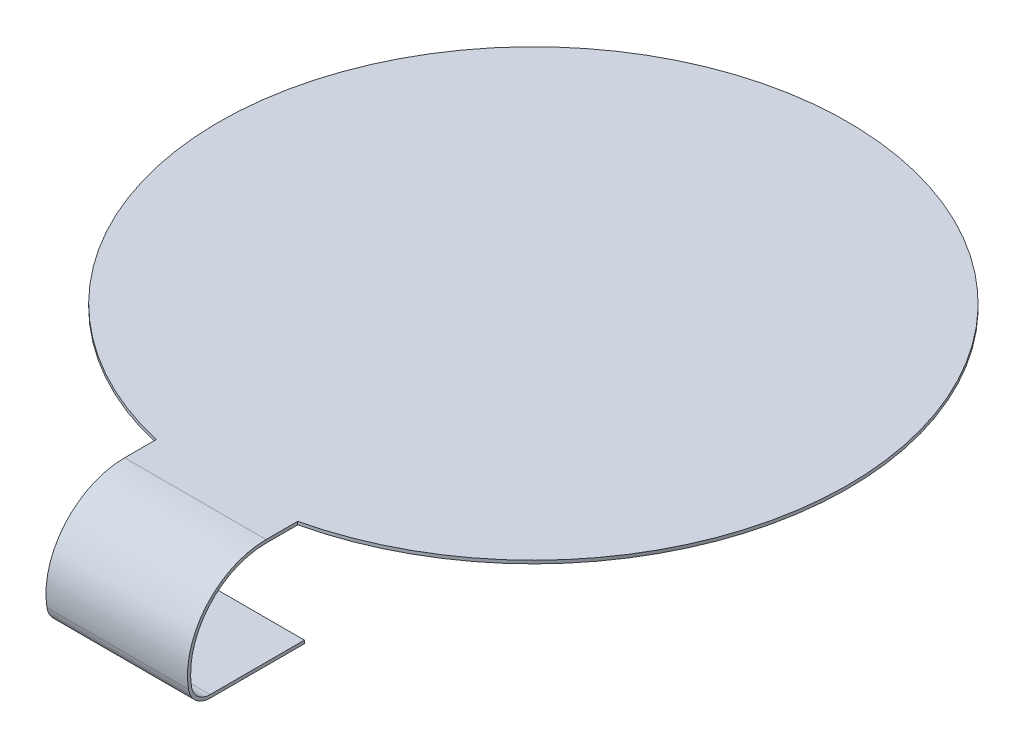
from build123d import *

# Parameters (mm, degrees)
SKETCH1_R                       = 10
BOSS_EXTRUDE1_DEPTH             = 0.1
BOSS_EXTRUDE2_START             = -2.28
SKETCH3_W                       = 4.5
SKETCH3_H                       = 2.5
BOSS_EXTRUDE2_DEPTH             = 0.1
EXTRUDE_THIN1_REACH             = 17.432
EXTRUDE_THIN1_DIRECTION_2_REACH = 17.432


with BuildPart() as part:
    # Sketch1 → Boss-Extrude1 (new body)
    with BuildSketch(Plane(origin=(0, 1.1, 0), x_dir=(1, 0, 0), z_dir=(0, 1, 0))):
        with Locations(Location((0, 1.53064501, 0), (0, 0, 270))):
            Circle(SKETCH1_R)
    extrude(amount=BOSS_EXTRUDE1_DEPTH)


with BuildPart() as body_2:
    # Sketch3 → Boss-Extrude2 (new body)
    with BuildSketch(Plane(origin=(0, 0, 0), x_dir=(1, 0, 0), z_dir=(0, 1, 0)).offset(BOSS_EXTRUDE2_START)):
        with Locations((0, -9.25)):
            Rectangle(SKETCH3_W, SKETCH3_H)
    extrude(amount=BOSS_EXTRUDE2_DEPTH)

    # Extrude-Thin1: up to this face of the body (flat: up to its plane)
    extrude_thin1_end = Plane(body_2.part.faces().sort_by_distance((2.25, -2.23, 9.25))[0])
    # Sketch4 → Extrude-Thin1 (add, up to the picked face)
    with BuildSketch(Plane(origin=(0, 0, 0), x_dir=(0, 0, -1), z_dir=(1, 0, 0)), mode=Mode.PRIVATE) as extrude_thin1_sk1:
        with BuildLine():
            Line((-9.5, -2.28), (-10.5, -2.28))
            Line((-10.5, -2.28), (-11, -2.28))
            ThreePointArc((-11, -2.28), (-11.452530048, -2.113120853), (-11.688368572, -1.692392575))
            ThreePointArc((-11.688368572, -1.692392575), (-11.120799367, 0.32311715), (-9.21935499, 1.2))
            Line((-9.21935499, 1.2), (-8.46935499, 1.2))
            Line((-8.46935499, 1.2), (-5, 1.2))
            Line((-5, 1.2), (-5, 1.1))
            Line((-5, 1.1), (-8.46935499, 1.1))
            Line((-8.46935499, 1.1), (-9.21935499, 1.1))
            ThreePointArc((-9.21935499, 1.1), (-11.044741592, 0.258192464), (-11.589608029, -1.676696872))
            ThreePointArc((-11.589608029, -1.676696872), (-11.387605362, -2.037063078), (-11, -2.18))
            Line((-11, -2.18), (-10.5, -2.18))
            Line((-10.5, -2.18), (-9.5, -2.18))
            Line((-9.5, -2.18), (-9.5, -2.28))
        make_face()
    extrude_thin1_tool1 = split(extrude(extrude_thin1_sk1.sketch, amount=EXTRUDE_THIN1_REACH, mode=Mode.PRIVATE), bisect_by=extrude_thin1_end, keep=Keep.BOTH, mode=Mode.PRIVATE)

    add(part.part)  # Extrude-Thin1 merges part
    add(extrude_thin1_tool1.solids().sort_by(Axis((0, -2.25567, 10.75), (1, 0, 0)))[0])

    # Extrude-Thin1 direction 2: up to this face of the body (flat: up to its plane)
    extrude_thin1_direction_2_end = Plane(body_2.part.faces().sort_by_distance((-2.25, -2.23, 9.25))[0])
    # Sketch4 → Extrude-Thin1 direction 2 (add, up to the picked face)
    with BuildSketch(Plane(origin=(0, 0, 0), x_dir=(0, 0, -1), z_dir=(1, 0, 0)), mode=Mode.PRIVATE) as extrude_thin1_direction_2_sk1:
        with BuildLine():
            Line((-9.5, -2.28), (-10.5, -2.28))
            Line((-10.5, -2.28), (-11, -2.28))
            ThreePointArc((-11, -2.28), (-11.452530048, -2.113120853), (-11.688368572, -1.692392575))
            ThreePointArc((-11.688368572, -1.692392575), (-11.120799367, 0.32311715), (-9.21935499, 1.2))
            Line((-9.21935499, 1.2), (-8.46935499, 1.2))
            Line((-8.46935499, 1.2), (-5, 1.2))
            Line((-5, 1.2), (-5, 1.1))
            Line((-5, 1.1), (-8.46935499, 1.1))
            Line((-8.46935499, 1.1), (-9.21935499, 1.1))
            ThreePointArc((-9.21935499, 1.1), (-11.044741592, 0.258192464), (-11.589608029, -1.676696872))
            ThreePointArc((-11.589608029, -1.676696872), (-11.387605362, -2.037063078), (-11, -2.18))
            Line((-11, -2.18), (-10.5, -2.18))
            Line((-10.5, -2.18), (-9.5, -2.18))
            Line((-9.5, -2.18), (-9.5, -2.28))
        make_face()
    extrude_thin1_direction_2_tool1 = split(extrude(extrude_thin1_direction_2_sk1.sketch, amount=-EXTRUDE_THIN1_DIRECTION_2_REACH, mode=Mode.PRIVATE), bisect_by=extrude_thin1_direction_2_end, keep=Keep.BOTH, mode=Mode.PRIVATE)
    add(extrude_thin1_direction_2_tool1.solids().sort_by(Axis((0, -2.25567, 10.75), (-1, 0, 0)))[0])


solid = body_2.part
